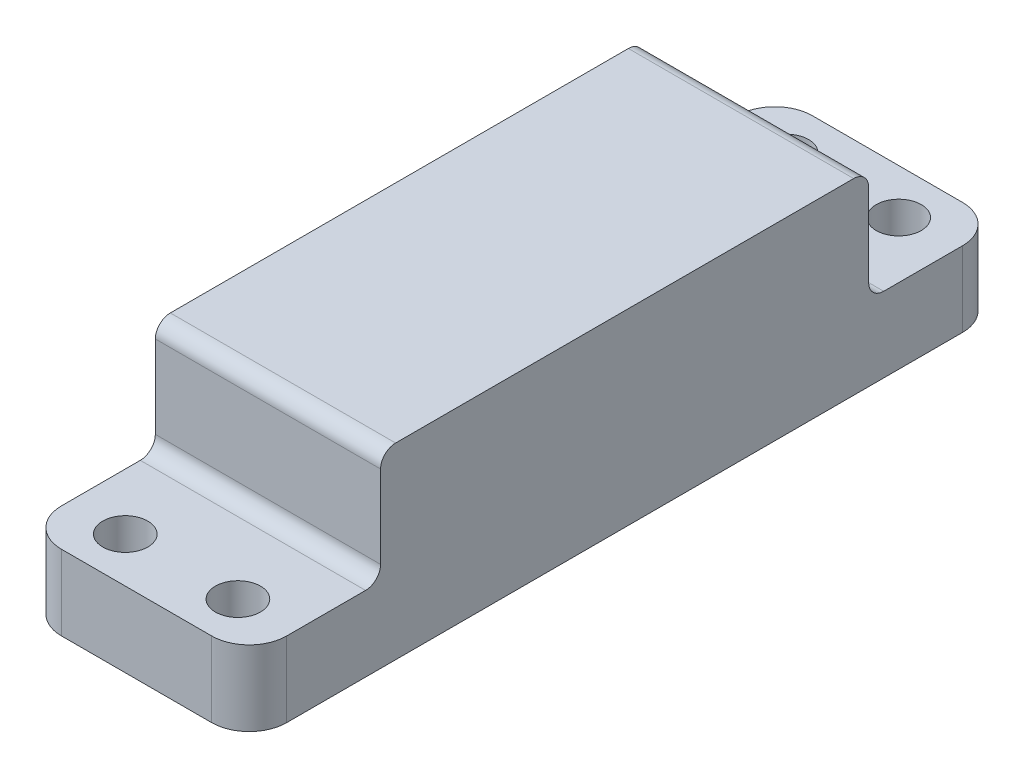
from build123d import *

# Parameters (mm, degrees)
BOSS_EXTRUDE1_DEPTH                      = 30
FILLET1_R                                = 10
CBORE_FOR_M12_HEX_HEAD_BOLT1_D           = 8
CBORE_FOR_M12_HEX_HEAD_BOLT1_CBORE_D     = 12
CBORE_FOR_M12_HEX_HEAD_BOLT1_CBORE_DEPTH = 10


with BuildPart() as part:
    # Sketch1 → Boss-Extrude1 (new, symmetric)
    with BuildSketch(Plane(origin=(0, 0, 0), x_dir=(0, 0, -1), z_dir=(1, 0, 0))):
        with BuildLine():
            Line((100, 0), (-100, 0))
            Line((-100, 0), (-100, 20))
            Line((-100, 20), (-69, 20))
            ThreePointArc((-69, 20), (-66.171572875, 21.171572875), (-65, 24))
            Line((-65, 24), (-65, 46))
            ThreePointArc((-65, 46), (-63.828427125, 48.828427125), (-61, 50))
            Line((-61, 50), (61, 50))
            ThreePointArc((61, 50), (63.828427125, 48.828427125), (65, 46))
            Line((65, 46), (65, 24))
            ThreePointArc((65, 24), (66.171572875, 21.171572875), (69, 20))
            Line((69, 20), (100, 20))
            Line((100, 20), (100, 0))
        make_face()
    extrude(amount=BOSS_EXTRUDE1_DEPTH, both=True)

    # Fillet1
    fillet1_edges = [part.edges().sort_by_distance(p)[0] for p in [
        (-30, 10, 100),
        (-30, 10, -100),
        (30, 10, 100),
        (30, 10, -100),
    ]]
    fillet(fillet1_edges, radius=FILLET1_R)

    # CBORE for M12 Hex Head Bolt1 (through all)
    with Locations(Plane(origin=(0, 20, 0), x_dir=(1, 0, 0), z_dir=(0, 1, 0))):
        with Locations((-15, -88), (15, -88), (15, 88), (-15, 88)):
            CounterBoreHole(CBORE_FOR_M12_HEX_HEAD_BOLT1_D / 2, CBORE_FOR_M12_HEX_HEAD_BOLT1_CBORE_D / 2, CBORE_FOR_M12_HEX_HEAD_BOLT1_CBORE_DEPTH)


solid = part.part
